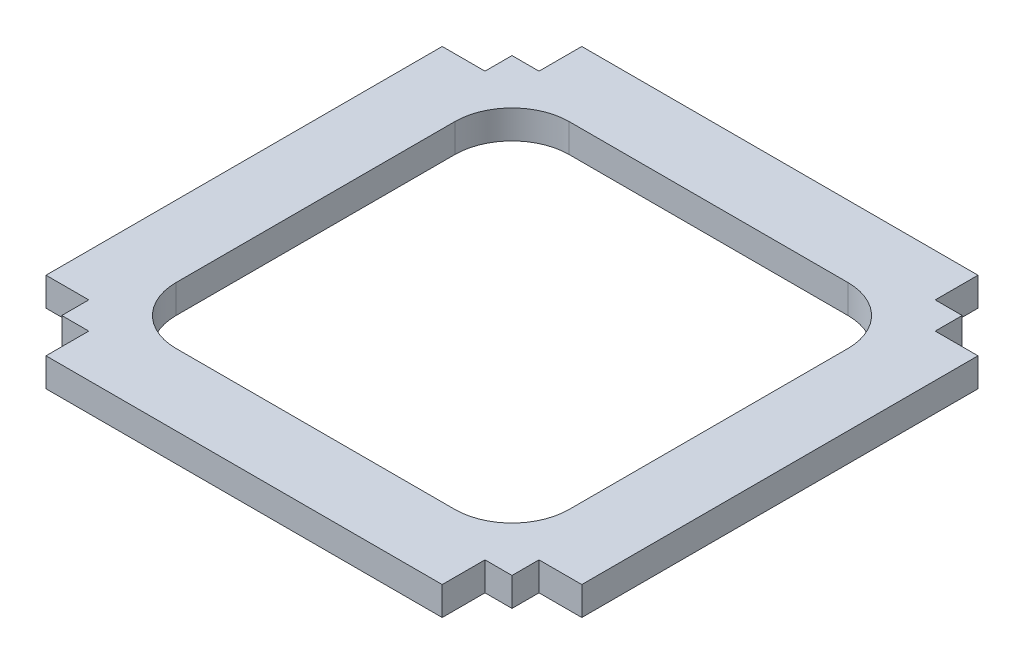
from build123d import *

# Parameters (mm, degrees)
BOSS_EXTRUDE1_DEPTH = 6.35
SKETCH2_W           = 87.3
SKETCH2_H           = 87.3
CUT_EXTRUDE1_DEPTH  = 6.35
FILLET1_R           = 12.7


with BuildPart() as part:
    # Sketch1 → Boss-Extrude1 (new body)
    with BuildSketch(Plane(origin=(0, 0, 0), x_dir=(1, 0, 0), z_dir=(0, 1, 0))):
        Polygon((-44, 50), (-50, 50), (-50, 44), (-59.5, 44), (-59.5, -44), (-50, -44), (-50, -50), (-44, -50), (-44, -59.5), (44, -59.5), (44, -50), (50, -50), (50, -44), (59.5, -44), (59.5, 44), (50, 44), (50, 50), (44, 50), (44, 59.5), (-44, 59.5), align=None)
    extrude(amount=BOSS_EXTRUDE1_DEPTH)

    # Sketch2 → Cut-Extrude1 (cut)
    with BuildSketch(Plane(origin=(0, 6.35, 0), x_dir=(1, 0, 0), z_dir=(0, 1, 0))):
        Rectangle(SKETCH2_W, SKETCH2_H)
    extrude(amount=-CUT_EXTRUDE1_DEPTH, mode=Mode.SUBTRACT)

    # Fillet1
    fillet1_edges = [part.edges().sort_by_distance(p)[0] for p in [
        (-43.65, 3.175, 43.65),
        (-43.65, 3.175, -43.65),
        (43.65, 3.175, -43.65),
        (43.65, 3.175, 43.65),
    ]]
    fillet(fillet1_edges, radius=FILLET1_R)


solid = part.part
